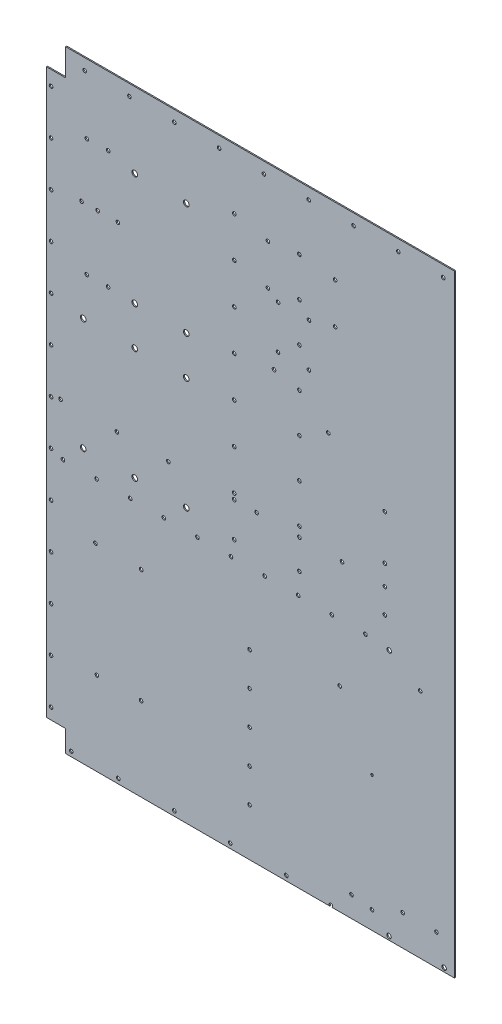
from build123d import *

# Parameters (mm, degrees)
SZKIC1_W                    = 376
SZKIC1_H                    = 545
DODANIE_WYCI_GNI_CIE1_DEPTH = 1
SZKIC2_W                    = 21
SZKIC2_H                    = 21
WYTNIJ_WYCI_GNI_CIE1_DEPTH  = 384.662106334
SZKIC3_W                    = 21
SZKIC3_H                    = 21
WYTNIJ_WYCI_GNI_CIE2_DEPTH  = 384.662106334
SZKIC4_W                    = 4
SZKIC4_H                    = 503
WYTNIJ_WYCI_GNI_CIE3_DEPTH  = 384.662106334
SZKIC5_W                    = 355
SZKIC5_H                    = 1
DODANIE_WYCI_GNI_CIE2_DEPTH = 1.5
SZKIC6_R                    = 1.6
SZKIC6_R_2                  = 1.141259073
SZKIC6_R_3                  = 2.012998401
SZKIC6_R_4                  = 2.000112964
SZKIC6_R_5                  = 2
WYTNIJ_WYCI_GNI_CIE4_DEPTH  = 382.512724941
SZKIC7_R                    = 1.6
WYTNIJ_WYCI_GNI_CIE5_DEPTH  = 382.512724941
SZKIC8_R                    = 2.5
SZKIC8_R_2                  = 1.6
WYTNIJ_WYCI_GNI_CIE6_DEPTH  = 382.512724941
SZKIC9_R                    = 1.6
WYTNIJ_WYCI_GNI_CIE7_DEPTH  = 382.512724941
SZKIC11_R                   = 1.6
WYTNIJ_WYCI_GNI_CIE8_DEPTH  = 382.512724941
SZKIC12_R                   = 1.6
WYTNIJ_WYCI_GNI_CIE9_DEPTH  = 382.512724941
SZKIC13_R                   = 1.6
WYTNIJ_WYCI_GNI_CIE10_DEPTH = 382.512724941
SZKIC14_R                   = 1.6
WYTNIJ_WYCI_GNI_CIE11_DEPTH = 382.512724941
SZKIC15_R                   = 1.6
WYTNIJ_WYCI_GNI_CIE12_DEPTH = 382.512724941
SZKIC16_W                   = 355
SZKIC16_H                   = 1
DODANIE_WYCI_GNI_CIE3_DEPTH = 1.6
WYTNIJ_WYCI_GNI_CIE13_START = -1.6
SZKIC17_W                   = 355
SZKIC17_H                   = 1
WYTNIJ_WYCI_GNI_CIE13_DEPTH = 1.6
SZKIC18_R                   = 1.6
WYTNIJ_WYCI_GNI_CIE14_DEPTH = 381.160527915
SZKIC19_R                   = 1.6
WYTNIJ_WYCI_GNI_CIE15_DEPTH = 381.160527915
SZKIC20_R                   = 1.6
WYTNIJ_WYCI_GNI_CIE16_DEPTH = 381.160527915
SZKIC23_W                   = 1
SZKIC23_H                   = 19.4
SZKIC23_H_2                 = 24.1
WYTNIJ_WYCI_GNI_CIE17_DEPTH = 8
SZKIC25_W                   = 1
SZKIC25_H                   = 503
WYTNIJ_WYCI_GNI_CIE18_DEPTH = 8
SZKIC28_R                   = 1.6
SZKIC28_R_2                 = 1.5907377
SZKIC28_R_3                 = 1.59073775
WYTNIJ_WYCI_GNI_CIE19_DEPTH = 376.937124923
SZKIC29_R                   = 1.6
SZKIC29_R_2                 = 1.590724094
SZKIC29_R_3                 = 1.599991679
SZKIC29_R_4                 = 1.599991213
WYTNIJ_WYCI_GNI_CIE20_DEPTH = 376.937124923


with BuildPart() as part:
    # Szkic1 → Dodanie-wyciągnięcie1 (new body)
    with BuildSketch(Plane.XY):
        with Locations((-19.581568061, -50.153846154)):
            Rectangle(SZKIC1_W, SZKIC1_H)
    extrude(amount=DODANIE_WYCI_GNI_CIE1_DEPTH)

    # Szkic2 → Wytnij-wyciągnięcie1 (cut, through all)
    with BuildSketch(Plane.XY.offset(1)):
        with Locations((-197.081568061, 211.846153846)):
            Rectangle(SZKIC2_W, SZKIC2_H)
    extrude(amount=-WYTNIJ_WYCI_GNI_CIE1_DEPTH, mode=Mode.SUBTRACT)

    # Szkic3 → Wytnij-wyciągnięcie2 (cut, through all)
    with BuildSketch(Plane.XY.offset(1)):
        with Locations((-197.081568061, -312.153846154)):
            Rectangle(SZKIC3_W, SZKIC3_H)
    extrude(amount=-WYTNIJ_WYCI_GNI_CIE2_DEPTH, mode=Mode.SUBTRACT)

    # Szkic4 → Wytnij-wyciągnięcie3 (cut, through all)
    with BuildSketch(Plane.XY.offset(1)):
        with Locations((-205.581568061, -50.153846154)):
            Rectangle(SZKIC4_W, SZKIC4_H)
    extrude(amount=-WYTNIJ_WYCI_GNI_CIE3_DEPTH, mode=Mode.SUBTRACT)

    # Szkic5 → Dodanie-wyciągnięcie2 (add)
    with BuildSketch(Plane(origin=(0, 222.346153846, 0), x_dir=(1, 0, 0), z_dir=(0, 1, 0))):
        with Locations((-9.081568061, -0.5)):
            Rectangle(SZKIC5_W, SZKIC5_H)
    extrude(amount=DODANIE_WYCI_GNI_CIE2_DEPTH)

    # Szkic6 → Wytnij-wyciągnięcie4 (cut, through all)
    with BuildSketch(Plane.XY.offset(1)):
        with Locations((66.118431939, -146.469212627)):
            Circle(SZKIC6_R)
        with Locations((76.618431939, -302.569212627)):
            Circle(SZKIC6_R)
        with Locations((58.218431939, -319.769212627)):
            Circle(SZKIC6_R)
        with Locations((94.918431939, -305.069212627)):
            Circle(SZKIC6_R)
        with Locations((94.918431939, -200.827684369)):
            Circle(SZKIC6_R_2)
        with Locations((110.318431939, -96.869212627)):
            Circle(SZKIC6_R_3)
        with Locations((137.918431939, -114.369212627)):
            Circle(SZKIC6_R)
        with Locations((152.468431939, -293.523394302)):
            Circle(SZKIC6_R)
        with Locations((122.273971677, -293.569212627)):
            Circle(SZKIC6_R)
        with Locations((110.118431939, -317.69046982)):
            Circle(SZKIC6_R_4)
        with Locations((159.318431939, -317.669212627)):
            Circle(SZKIC6_R_5)
    extrude(amount=-WYTNIJ_WYCI_GNI_CIE4_DEPTH, mode=Mode.SUBTRACT)

    # Szkic7 → Wytnij-wyciągnięcie5 (cut, through all)
    with BuildSketch(Plane.XY.offset(1)):
        with Locations((-111.202771854, -246.494726622)):
            Circle(SZKIC7_R)
        with Locations((-111.202771854, -145.094726622)):
            Circle(SZKIC7_R)
        with Locations((-151.952771854, -145.094726622)):
            Circle(SZKIC7_R)
        with Locations((-150.702771854, -246.494726622)):
            Circle(SZKIC7_R)
    extrude(amount=-WYTNIJ_WYCI_GNI_CIE5_DEPTH, mode=Mode.SUBTRACT)

    # Szkic8 → Wytnij-wyciągnięcie6 (cut, through all)
    with BuildSketch(Plane.XY.offset(1)):
        with Locations((-70.852771854, -77.159091592)):
            Circle(SZKIC8_R)
        with Locations((-70.852771854, 23.140908408)):
            Circle(SZKIC8_R)
        with Locations((-70.852771854, 57.840908408)):
            Circle(SZKIC8_R)
        with Locations((-70.852771854, 158.140908408)):
            Circle(SZKIC8_R)
        with Locations((-116.852771854, -77.159091592)):
            Circle(SZKIC8_R)
        with Locations((-116.852771854, 23.140908408)):
            Circle(SZKIC8_R)
        with Locations((-162.852771854, -77.159091592)):
            Circle(SZKIC8_R)
        with Locations((-162.852771854, 23.140908408)):
            Circle(SZKIC8_R)
        with Locations((-116.852771854, 57.840908408)):
            Circle(SZKIC8_R)
        with Locations((-116.852771854, 158.140908408)):
            Circle(SZKIC8_R)
        with Locations((-164.34925646, 112.910647702)):
            Circle(SZKIC8_R_2)
        with Locations((-149.962663681, 112.910647702)):
            Circle(SZKIC8_R_2)
        with Locations((-131.890271854, 112.910647702)):
            Circle(SZKIC8_R_2)
    extrude(amount=-WYTNIJ_WYCI_GNI_CIE6_DEPTH, mode=Mode.SUBTRACT)

    # Szkic9 → Wytnij-wyciągnięcie7 (cut, through all)
    with BuildSketch(Plane.XY.offset(1)):
        with Locations((-180.944714948, -94.986182523)):
            Circle(SZKIC9_R)
        with Locations((-150.944714948, -94.986182523)):
            Circle(SZKIC9_R)
        with Locations((-120.944714948, -94.986182523)):
            Circle(SZKIC9_R)
        with Locations((-90.944714948, -94.986182523)):
            Circle(SZKIC9_R)
        with Locations((-60.944714948, -94.986182523)):
            Circle(SZKIC9_R)
        with Locations((-30.944714948, -94.986182523)):
            Circle(SZKIC9_R)
        with Locations((-0.944714948, -94.986182523)):
            Circle(SZKIC9_R)
        with Locations((29.055285052, -94.986182523)):
            Circle(SZKIC9_R)
        with Locations((59.055285052, -94.986182523)):
            Circle(SZKIC9_R)
        with Locations((89.055285052, -94.986182523)):
            Circle(SZKIC9_R)
    extrude(amount=-WYTNIJ_WYCI_GNI_CIE7_DEPTH, mode=Mode.SUBTRACT)

    # Szkic11 → Wytnij-wyciągnięcie8 (cut, through all)
    with BuildSketch(Plane.XY.offset(1)):
        with Locations((-28.052771854, -80.486182523)):
            Circle(SZKIC11_R)
        with Locations((-28.052771854, -44.486182523)):
            Circle(SZKIC11_R)
        with Locations((-28.052771854, -8.486182523)):
            Circle(SZKIC11_R)
        with Locations((-28.052771854, 27.513817477)):
            Circle(SZKIC11_R)
        with Locations((-28.052771854, 63.513817477)):
            Circle(SZKIC11_R)
        with Locations((-28.052771854, 99.513817477)):
            Circle(SZKIC11_R)
        with Locations((-28.052771854, 135.513817477)):
            Circle(SZKIC11_R)
        with Locations((-28.052771854, 171.513817477)):
            Circle(SZKIC11_R)
    extrude(amount=-WYTNIJ_WYCI_GNI_CIE8_DEPTH, mode=Mode.SUBTRACT)

    # Szkic12 → Wytnij-wyciągnięcie9 (cut, through all)
    with BuildSketch(Plane.XY.offset(1)):
        with Locations((30.122228145, 169.130787373)):
            Circle(SZKIC12_R)
        with Locations((30.122228145, 134.130787373)):
            Circle(SZKIC12_R)
        with Locations((30.122228145, 99.130787373)):
            Circle(SZKIC12_R)
        with Locations((30.122228145, 64.130787373)):
            Circle(SZKIC12_R)
        with Locations((30.122228145, 29.130787373)):
            Circle(SZKIC12_R)
        with Locations((30.122228145, -5.869212627)):
            Circle(SZKIC12_R)
        with Locations((30.122228145, -40.869212627)):
            Circle(SZKIC12_R)
        with Locations((30.122228145, -75.869212627)):
            Circle(SZKIC12_R)
    extrude(amount=-WYTNIJ_WYCI_GNI_CIE9_DEPTH, mode=Mode.SUBTRACT)

    # Szkic13 → Wytnij-wyciągnięcie10 (cut, through all)
    with BuildSketch(Plane.XY.offset(1)):
        with Locations((106.396438665, 8.530787373)):
            Circle(SZKIC13_R)
        with Locations((106.396438665, -31.469212627)):
            Circle(SZKIC13_R)
        with Locations((106.396438665, -71.469212627)):
            Circle(SZKIC13_R)
    extrude(amount=-WYTNIJ_WYCI_GNI_CIE10_DEPTH, mode=Mode.SUBTRACT)

    # Szkic14 → Wytnij-wyciągnięcie11 (cut, through all)
    with BuildSketch(Plane.XY.offset(1)):
        with Locations((-14.382568062, -158.669212627)):
            Circle(SZKIC14_R)
        with Locations((-14.382568062, -188.669212627)):
            Circle(SZKIC14_R)
        with Locations((-14.382568062, -218.669212627)):
            Circle(SZKIC14_R)
        with Locations((-14.382568062, -248.669212627)):
            Circle(SZKIC14_R)
        with Locations((-14.382568062, -278.669212627)):
            Circle(SZKIC14_R)
    extrude(amount=-WYTNIJ_WYCI_GNI_CIE11_DEPTH, mode=Mode.SUBTRACT)

    # Szkic15 → Wytnij-wyciągnięcie12 (cut, through all)
    with BuildSketch(Plane(origin=(0, 0, 0), x_dir=(-1, 0, 0), z_dir=(0, 0, -1))):
        with Locations((183.081568061, -49.509212627)):
            Circle(SZKIC15_R)
        with Locations((28.052771854, -49.509212627)):
            Circle(SZKIC15_R)
        with Locations((8.13477938, -49.509212627)):
            Circle(SZKIC15_R)
        with Locations((-30.122228145, -49.509212627)):
            Circle(SZKIC15_R)
        with Locations((-68.167846897, -49.509212627)):
            Circle(SZKIC15_R)
        with Locations((-106.396438665, -49.509212627)):
            Circle(SZKIC15_R)
        with Locations((132.767260269, -49.509212627)):
            Circle(SZKIC15_R)
        with Locations((86.886296242, -49.509212627)):
            Circle(SZKIC15_R)
    extrude(amount=-WYTNIJ_WYCI_GNI_CIE12_DEPTH, mode=Mode.SUBTRACT)

    # Szkic16 → Dodanie-wyciągnięcie3 (add)
    with BuildSketch(Plane(origin=(0, 223.846153846, 0), x_dir=(1, 0, 0), z_dir=(0, 1, 0))):
        with Locations((-9.081568061, -0.5)):
            Rectangle(SZKIC16_W, SZKIC16_H)
    extrude(amount=DODANIE_WYCI_GNI_CIE3_DEPTH)

    # Szkic17 → Wytnij-wyciągnięcie13 (cut)
    with BuildSketch(Plane.XZ.offset(322.653846154).offset(WYTNIJ_WYCI_GNI_CIE13_START)):
        with Locations((-9.081568061, 0.5)):
            Rectangle(SZKIC17_W, SZKIC17_H)
    extrude(amount=WYTNIJ_WYCI_GNI_CIE13_DEPTH, mode=Mode.SUBTRACT)

    # Szkic18 → Wytnij-wyciągnięcie14 (cut, through all)
    with BuildSketch(Plane.XY.offset(1)):
        with Locations((158.418431939, 215.446153846)):
            Circle(SZKIC18_R)
        with Locations((118.418431939, 215.446153846)):
            Circle(SZKIC18_R)
        with Locations((78.418431939, 215.446153846)):
            Circle(SZKIC18_R)
        with Locations((38.418431939, 215.446153846)):
            Circle(SZKIC18_R)
        with Locations((-1.581568061, 215.446153846)):
            Circle(SZKIC18_R)
        with Locations((-41.581568061, 215.446153846)):
            Circle(SZKIC18_R)
        with Locations((-81.581568061, 215.446153846)):
            Circle(SZKIC18_R)
        with Locations((-121.581568061, 215.446153846)):
            Circle(SZKIC18_R)
        with Locations((-161.581568061, 215.446153846)):
            Circle(SZKIC18_R)
    extrude(amount=-WYTNIJ_WYCI_GNI_CIE14_DEPTH, mode=Mode.SUBTRACT)

    # Szkic19 → Wytnij-wyciągnięcie15 (cut, through all)
    with BuildSketch(Plane.XY.offset(1)):
        with Locations((-131.581568061, -316.803846154)):
            Circle(SZKIC19_R)
        with Locations((-81.581568061, -316.803846154)):
            Circle(SZKIC19_R)
        with Locations((-31.581568061, -316.803846154)):
            Circle(SZKIC19_R)
        with Locations((18.418431939, -316.803846154)):
            Circle(SZKIC19_R)
        with Locations((-173.581568061, -316.803846154)):
            Circle(SZKIC19_R)
    extrude(amount=-WYTNIJ_WYCI_GNI_CIE15_DEPTH, mode=Mode.SUBTRACT)

    # Szkic20 → Wytnij-wyciągnięcie16 (cut, through all)
    with BuildSketch(Plane.XY.offset(1)):
        with Locations((-191.581568061, -291.653846154)):
            Circle(SZKIC20_R)
        with Locations((-191.581568061, -251.653846154)):
            Circle(SZKIC20_R)
        with Locations((-191.581568061, -211.653846154)):
            Circle(SZKIC20_R)
        with Locations((-191.581568061, -171.653846154)):
            Circle(SZKIC20_R)
        with Locations((-191.581568061, -131.653846154)):
            Circle(SZKIC20_R)
        with Locations((-191.581568061, -91.653846154)):
            Circle(SZKIC20_R)
        with Locations((-191.581568061, -51.653846154)):
            Circle(SZKIC20_R)
        with Locations((-191.581568061, -11.653846154)):
            Circle(SZKIC20_R)
        with Locations((-191.581568061, 28.346153846)):
            Circle(SZKIC20_R)
        with Locations((-191.581568061, 68.346153846)):
            Circle(SZKIC20_R)
        with Locations((-191.581568061, 108.346153846)):
            Circle(SZKIC20_R)
        with Locations((-191.581568061, 148.346153846)):
            Circle(SZKIC20_R)
        with Locations((-191.581568061, 188.346153846)):
            Circle(SZKIC20_R)
    extrude(amount=-WYTNIJ_WYCI_GNI_CIE16_DEPTH, mode=Mode.SUBTRACT)

    # Szkic23 → Wytnij-wyciągnięcie17 (cut)
    with BuildSketch(Plane.ZY.offset(186.581568061)):
        with Locations((0.5, -311.353846154)):
            Rectangle(SZKIC23_W, SZKIC23_H)
        with Locations((0.5, 213.396153846)):
            Rectangle(SZKIC23_W, SZKIC23_H_2)
    extrude(amount=-WYTNIJ_WYCI_GNI_CIE17_DEPTH, mode=Mode.SUBTRACT)

    # Szkic25 → Wytnij-wyciągnięcie18 (cut)
    with BuildSketch(Plane.ZY.offset(203.581568061)):
        with Locations((0.5, -50.153846154)):
            Rectangle(SZKIC25_W, SZKIC25_H)
    extrude(amount=-WYTNIJ_WYCI_GNI_CIE18_DEPTH, mode=Mode.SUBTRACT)

    # Szkic28 → Wytnij-wyciągnięcie19 (cut, through all)
    with BuildSketch(Plane.XY.offset(1)):
        with Locations((-159.677771854, 58.645783569)):
            Circle(SZKIC28_R)
        with Locations((-140.627771854, 58.640397592)):
            Circle(SZKIC28_R_2)
        with Locations((-159.677771804, 163.638289629)):
            Circle(SZKIC28_R_3)
        with Locations((-140.627771854, 164.048281348)):
            Circle(SZKIC28_R_2)
    extrude(amount=-WYTNIJ_WYCI_GNI_CIE19_DEPTH, mode=Mode.SUBTRACT)

    # Szkic29 → Wytnij-wyciągnięcie20 (cut, through all)
    with BuildSketch(Plane.XY.offset(1)):
        with Locations((7.443957822, 68.823890821)):
            Circle(SZKIC29_R)
        with Locations((55.874611739, 44.023890821)):
            Circle(SZKIC29_R_2)
        with Locations((11.025285923, 84.023890821)):
            Circle(SZKIC29_R)
        with Locations((38.624731829, 84.023890821)):
            Circle(SZKIC29_R)
        with Locations((38.686829559, 122.623890821)):
            Circle(SZKIC29_R)
        with Locations((11.087383652, 122.623890821)):
            Circle(SZKIC29_R)
        with Locations((1.986805564, 129.073890821)):
            Circle(SZKIC29_R)
        with Locations((1.986805564, 165.373890821)):
            Circle(SZKIC29_R)
        with Locations((61.985601014, 165.373890821)):
            Circle(SZKIC29_R_3)
        with Locations((61.985601014, 129.073890821)):
            Circle(SZKIC29_R_4)
    extrude(amount=-WYTNIJ_WYCI_GNI_CIE20_DEPTH, mode=Mode.SUBTRACT)


solid = part.part
